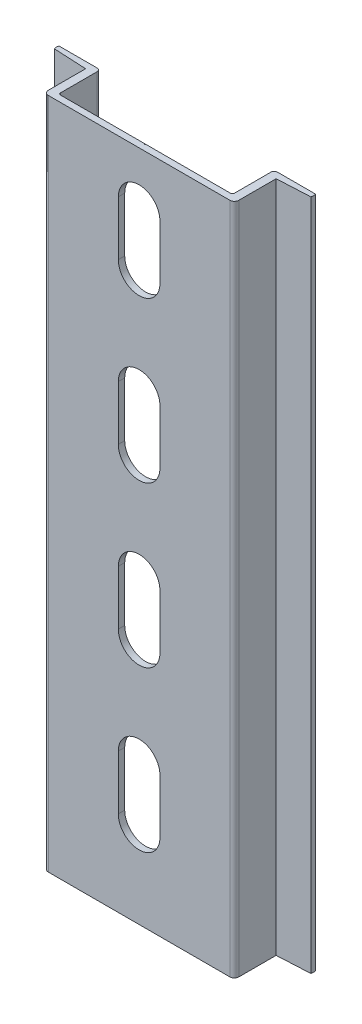
from build123d import *

# Parameters (mm, degrees)
SALIENTE_EXTRUIR1_DEPTH      = 105
SALIENTE_EXTRUIR1_DEPTH_BACK = 0.1
CORTAR_EXTRUIR4_DEPTH        = 10
CROQUIS4_W                   = 0.15
CROQUIS4_H                   = 10
CORTAR_EXTRUIR9_DEPTH        = 0.1


with BuildPart() as part:
    # Croquis1 → Saliente-Extruir1 (new, two sides: drawn at the far end of the back side and taken through both)
    with BuildSketch(Plane(origin=(0, 0, 0), x_dir=(1, 0, 0), z_dir=(0, 1, 0)).offset(-SALIENTE_EXTRUIR1_DEPTH_BACK)):
        with BuildLine():
            Line((34.919955981, -1.488391566), (40.072080634, -1.226803632))
            add(Edge.make_bspline(
                [(40.072080634, -0.488391566), (40.190854748, -0.858541724), (40.072080634, -1.226803632)],
                knots=[0, 0, 0, 1, 1, 1], degree=2))
            Line((40.072080634, -0.488391566), (34.119955981, -0.488391566))
            ThreePointArc((34.119955981, -0.488391566), (33.766402591, -0.634838176), (33.619955981, -0.988391566))
            Line((33.619955981, -0.988391566), (33.619955981, -6.714416127))
            ThreePointArc((33.619955981, -6.714416127), (33.532088016, -6.926548161), (33.319955981, -7.014416127))
            Line((33.319955981, -7.014416127), (6.752124653, -7.014416127))
            ThreePointArc((6.752124653, -7.014416127), (6.539992619, -6.926548161), (6.452124653, -6.714416127))
            Line((6.452124653, -6.714416127), (6.452124653, -0.988391566))
            ThreePointArc((6.452124653, -0.988391566), (6.305678044, -0.634838176), (5.952124653, -0.488391566))
            Line((5.952124653, -0.488391566), (0, -0.488391566))
            add(Edge.make_bspline(
                [(0, -0.488391566), (-0.118774114, -0.858541724), (0, -1.226803632)],
                knots=[0, 0, 0, 1, 1, 1], degree=2))
            Line((0, -1.226803632), (5.152124653, -1.488391566))
            Line((5.152124653, -1.488391566), (5.152124653, -7.314416127))
            ThreePointArc((5.152124653, -7.314416127), (5.357149906, -7.809390874), (5.852124653, -8.014416127))
            Line((5.852124653, -8.014416127), (34.219955981, -8.014416127))
            ThreePointArc((34.219955981, -8.014416127), (34.714930728, -7.809390874), (34.919955981, -7.314416127))
            Line((34.919955981, -7.314416127), (34.919955981, -1.488391566))
        make_face()
    extrude(amount=SALIENTE_EXTRUIR1_DEPTH + SALIENTE_EXTRUIR1_DEPTH_BACK)

    # Croquis2 → Cortar-Extruir4 (cut)
    with BuildSketch(Plane.XY.offset(8.014416127)):
        with BuildLine():
            Line((16.786040317, 38.25), (16.786040317, 46.75))
            ThreePointArc((16.786040317, 46.75), (20.036040317, 50), (23.286040317, 46.75))
            Line((23.286040317, 46.75), (23.286040317, 38.25))
            ThreePointArc((23.286040317, 38.25), (20.036040317, 35), (16.786040317, 38.25))
        make_face()
        with BuildLine():
            Line((16.786040317, 13.25), (16.786040317, 21.75))
            ThreePointArc((16.786040317, 21.75), (20.036040317, 25), (23.286040317, 21.75))
            Line((23.286040317, 21.75), (23.286040317, 13.25))
            ThreePointArc((23.286040317, 13.25), (20.036040317, 10), (16.786040317, 13.25))
        make_face()
        with BuildLine():
            Line((16.786040317, 63.25), (16.786040317, 71.75))
            ThreePointArc((16.786040317, 71.75), (20.036040317, 75), (23.286040317, 71.75))
            Line((23.286040317, 71.75), (23.286040317, 63.25))
            ThreePointArc((23.286040317, 63.25), (20.036040317, 60), (16.786040317, 63.25))
        make_face()
        with BuildLine():
            Line((16.786040317, 88.25), (16.786040317, 96.75))
            ThreePointArc((16.786040317, 96.75), (20.036040317, 100), (23.286040317, 96.75))
            Line((23.286040317, 96.75), (23.286040317, 88.25))
            ThreePointArc((23.286040317, 88.25), (20.036040317, 85), (16.786040317, 88.25))
        make_face()
        with BuildLine():
            Line((16.786040317, 113.25), (16.786040317, 121.75))
            ThreePointArc((16.786040317, 121.75), (20.036040317, 125), (23.286040317, 121.75))
            Line((23.286040317, 121.75), (23.286040317, 113.25))
            ThreePointArc((23.286040317, 113.25), (20.036040317, 110), (16.786040317, 113.25))
        make_face()
        with BuildLine():
            Line((16.786040317, 138.25), (16.786040317, 146.75))
            ThreePointArc((16.786040317, 146.75), (20.036040317, 150), (23.286040317, 146.75))
            Line((23.286040317, 146.75), (23.286040317, 138.25))
            ThreePointArc((23.286040317, 138.25), (20.036040317, 135), (16.786040317, 138.25))
        make_face()
        with BuildLine():
            Line((16.786040317, 163.25), (16.786040317, 171.75))
            ThreePointArc((16.786040317, 171.75), (20.036040317, 175), (23.286040317, 171.75))
            Line((23.286040317, 171.75), (23.286040317, 163.25))
            ThreePointArc((23.286040317, 163.25), (20.036040317, 160), (16.786040317, 163.25))
        make_face()
        with BuildLine():
            Line((16.786040317, 188.25), (16.786040317, 196.75))
            ThreePointArc((16.786040317, 196.75), (20.036040317, 200), (23.286040317, 196.75))
            Line((23.286040317, 196.75), (23.286040317, 188.25))
            ThreePointArc((23.286040317, 188.25), (20.036040317, 185), (16.786040317, 188.25))
        make_face()
    extrude(amount=-CORTAR_EXTRUIR4_DEPTH, mode=Mode.SUBTRACT)

    # Croquis4 → Cortar-Extruir9 (cut)
    with BuildSketch(Plane(origin=(0, 0, 7.014416127), x_dir=(-1, 0, 0), z_dir=(0, 0, -1))):
        with Locations((-20.036040317, 29.95)):
            Rectangle(CROQUIS4_W, CROQUIS4_H)
        with Locations((-20.036040317, 4.95)):
            Rectangle(CROQUIS4_W, CROQUIS4_H)
        with Locations((-20.036040317, 54.95)):
            Rectangle(CROQUIS4_W, CROQUIS4_H)
        with Locations((-20.036040317, 79.95)):
            Rectangle(CROQUIS4_W, CROQUIS4_H)
        with Locations((-20.036040317, 104.95)):
            Rectangle(CROQUIS4_W, CROQUIS4_H)
        with Locations((-20.036040317, 129.95)):
            Rectangle(CROQUIS4_W, CROQUIS4_H)
        with Locations((-20.036040317, 154.95)):
            Rectangle(CROQUIS4_W, CROQUIS4_H)
        with Locations((-20.036040317, 179.95)):
            Rectangle(CROQUIS4_W, CROQUIS4_H)
    extrude(amount=-CORTAR_EXTRUIR9_DEPTH, mode=Mode.SUBTRACT)


solid = part.part
